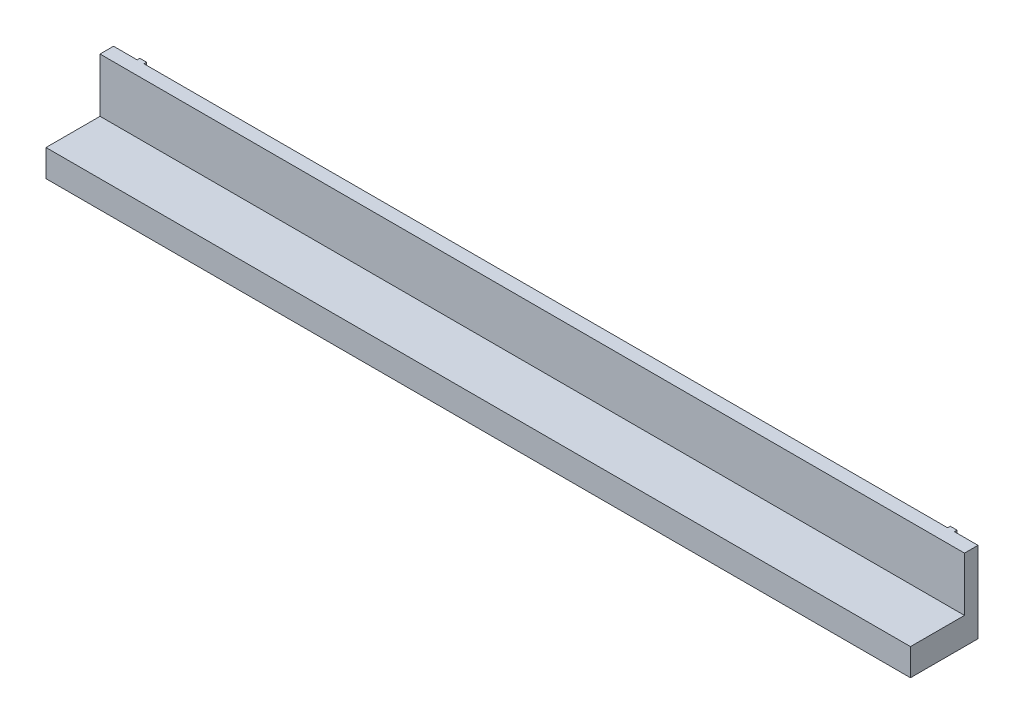
from build123d import *

# Parameters (mm, degrees)
SKETCH1_W           = 812.8
SKETCH1_H           = 76.114888738
BOSS_EXTRUDE1_DEPTH = 12.7
BOSS_EXTRUDE2_DEPTH = 25.4
SKETCH3_W           = 6.35
SKETCH3_H           = 76.114888738
BOSS_EXTRUDE4_DEPTH = 2.54


with BuildPart() as part:
    # Sketch1 → Boss-Extrude1 (new body)
    with BuildSketch(Plane.XY):
        with Locations((406.4, 38.057444369)):
            Rectangle(SKETCH1_W, SKETCH1_H)
    extrude(amount=BOSS_EXTRUDE1_DEPTH)

    # Sketch2 → Boss-Extrude2 (add)
    with BuildSketch(Plane.XZ):
        Polygon((0, 12.7), (0, 63.5), (812.8, 63.5), (812.8, 12.7), (812.8, 0), (0, 0), align=None)
    extrude(amount=-BOSS_EXTRUDE2_DEPTH)

    # Sketch3 → Boss-Extrude4 (add)
    with BuildSketch(Plane(origin=(0, 0, 0), x_dir=(-1, 0, 0), z_dir=(0, 0, -1))):
        with Locations((-787.4, 38.057444369)):
            Rectangle(SKETCH3_W, SKETCH3_H)
        with Locations((-25.4, 38.057444369)):
            Rectangle(SKETCH3_W, SKETCH3_H)
    extrude(amount=BOSS_EXTRUDE4_DEPTH)


solid = part.part
